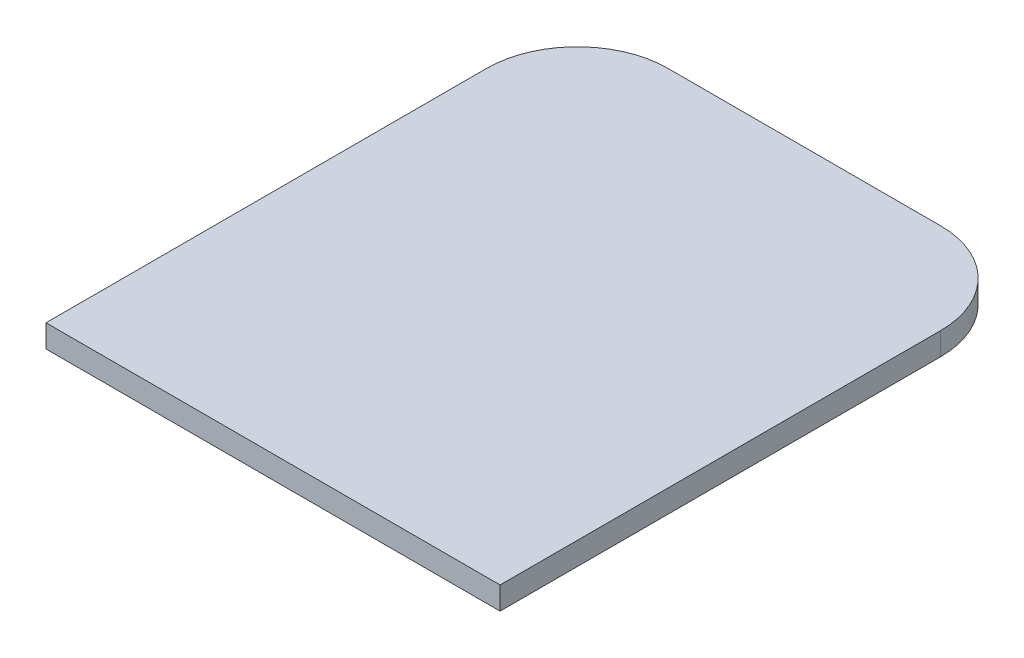
from build123d import *

# Parameters (mm, degrees)
BOSS_EXTRUDE1_DEPTH = 1


with BuildPart() as part:
    # Sketch1 → Boss-Extrude1 (new body)
    with BuildSketch(Plane(origin=(0, 0, 0), x_dir=(1, 0, 0), z_dir=(0, 1, 0))):
        with BuildLine():
            Line((0, 0), (-20, 0))
            Line((-20, 0), (-20, 19.4))
            ThreePointArc((-20, 19.4), (-18.828427125, 22.228427125), (-16, 23.4))
            Line((-16, 23.4), (-4, 23.4))
            ThreePointArc((-4, 23.4), (-1.171572875, 22.228427125), (0, 19.4))
            Line((0, 19.4), (0, 0))
        make_face()
    extrude(amount=BOSS_EXTRUDE1_DEPTH)


solid = part.part
